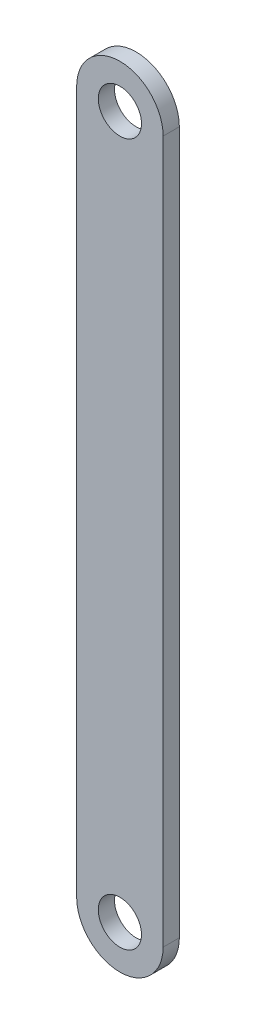
from build123d import *

# Parameters (mm, degrees)
BOSS_EXTRUDE1_DEPTH = 1.5
SKETCH2_R           = 2
CUT_EXTRUDE1_DEPTH  = 2


with BuildPart() as part:
    # Sketch1 → Boss-Extrude1 (new body)
    with BuildSketch(Plane.XY):
        with BuildLine():
            Line((-12.588235294, 0), (-12.588235294, -65))
            ThreePointArc((-12.588235294, -65), (-8.588235294, -69), (-4.588235294, -65))
            Line((-4.588235294, -65), (-4.588235294, 0))
            ThreePointArc((-4.588235294, 0), (-8.588235294, 4), (-12.588235294, 0))
        make_face()
    extrude(amount=BOSS_EXTRUDE1_DEPTH)

    # Sketch2 → Cut-Extrude1 (cut)
    with BuildSketch(Plane.XY.offset(1.5)):
        with Locations((-8.588235294, 0)):
            Circle(SKETCH2_R)
        with Locations((-8.588235294, -65)):
            Circle(SKETCH2_R)
    extrude(amount=-CUT_EXTRUDE1_DEPTH, mode=Mode.SUBTRACT)


solid = part.part
